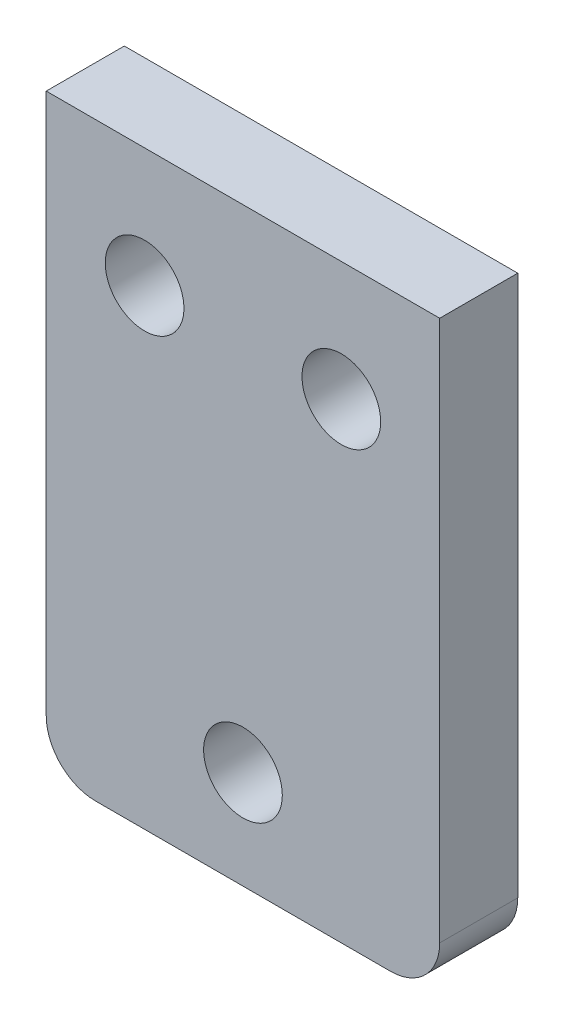
from build123d import *

# Parameters (mm, degrees)
SKETCH1_W           = 16
SKETCH1_H           = 24
SKETCH1_R           = 1.6
BOSS_EXTRUDE1_DEPTH = 3.175
FILLET1_R           = 2


with BuildPart() as part:
    # Sketch1 → Boss-Extrude1 (new body)
    with BuildSketch(Plane.XY):
        with Locations((0, -38)):
            Rectangle(SKETCH1_W, SKETCH1_H)
        with Locations((4, -30.85)):
            Circle(SKETCH1_R, mode=Mode.SUBTRACT)
        with Locations(Location((-4, -30.85, 0), (0, 0, 180))):
            Circle(SKETCH1_R, mode=Mode.SUBTRACT)
        with Locations((0, -46)):
            Circle(SKETCH1_R, mode=Mode.SUBTRACT)
    extrude(amount=BOSS_EXTRUDE1_DEPTH)

    # Fillet1
    fillet1_edges = [part.edges().sort_by_distance(p)[0] for p in [
        (8, -50, 1.5875),
        (-8, -50, 1.5875),
    ]]
    fillet(fillet1_edges, radius=FILLET1_R)


solid = part.part
